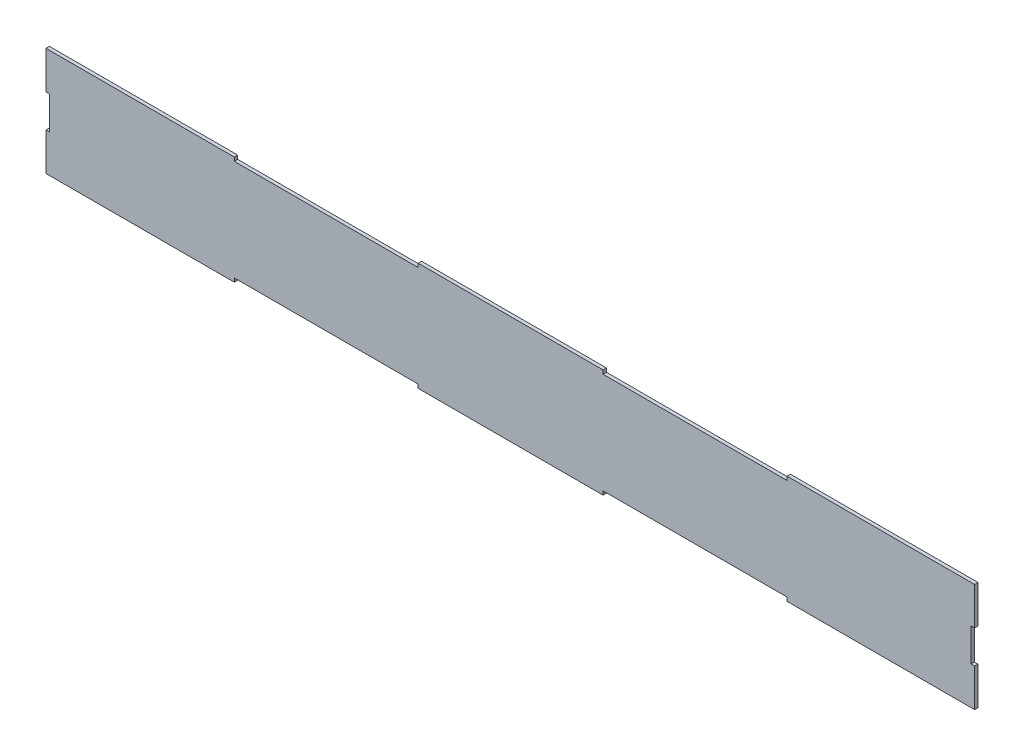
from build123d import *

# Parameters (mm, degrees)
BOSS_EXTRUDE1_DEPTH = 1.6


with BuildPart() as part:
    # Sketch1 → Boss-Extrude1 (new body)
    with BuildSketch(Plane.XY):
        Polygon((-43.3333329, 0), (-129.8399987, 0), (-129.8399987, -1.76), (-216.6666645, -1.76), (-218.4266645, -1.76), (-218.4266645, 0), (-218.4266645, 15.993333333), (-216.6666645, 15.993333333), (-216.6666645, 23.75), (216.6666645, 23.75), (216.6666645, 15.993333333), (218.4266645, 15.993333333), (218.4266645, 0), (218.4266645, -1.76), (216.6666645, -1.76), (130.1599987, -1.76), (130.1599987, 0), (43.6533329, 0), (43.6533329, -1.76), (-43.3333329, -1.76), align=None)
    boss_extrude1 = extrude(amount=BOSS_EXTRUDE1_DEPTH)

    # Mirror1: Boss-Extrude1 across plane
    add(boss_extrude1.mirror(Plane(origin=(216.6666645, 23.75, 1.6), x_dir=(0, 0, 1), z_dir=(0, -1, 0))))


solid = part.part
